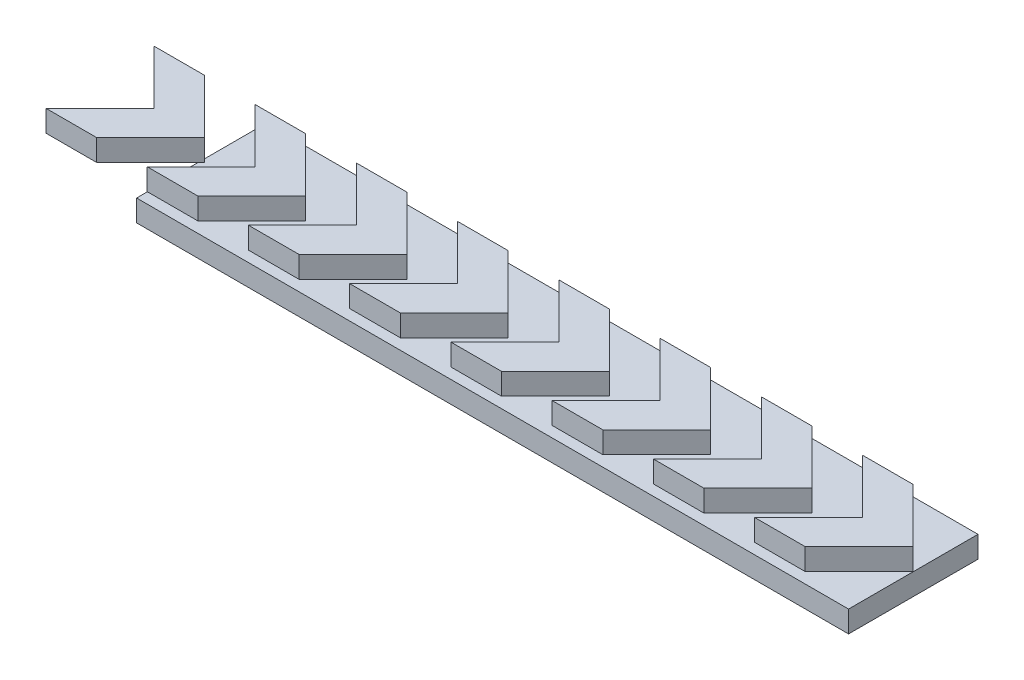
from build123d import *

# Parameters (mm, degrees)
SKETCH1_W             = 330
SKETCH1_H             = 60
BOSS_EXTRUDE1_DEPTH   = 10
BOSS_EXTRUDE2_DEPTH   = 10
BOSS_EXTRUDE2_2_DEPTH = 10
BOSS_EXTRUDE2_3_DEPTH = 10
BOSS_EXTRUDE2_4_DEPTH = 10
BOSS_EXTRUDE2_5_DEPTH = 10
BOSS_EXTRUDE2_6_DEPTH = 10
BOSS_EXTRUDE2_7_DEPTH = 10
BOSS_EXTRUDE2_8_DEPTH = 10


with BuildPart() as part:
    # Sketch1 → Boss-Extrude1 (new body)
    with BuildSketch(Plane(origin=(0, 0, 0), x_dir=(1, 0, 0), z_dir=(0, 1, 0))):
        Rectangle(SKETCH1_W, SKETCH1_H)
    extrude(amount=BOSS_EXTRUDE1_DEPTH)


with BuildPart() as body_2:
    # Sketch2 → Boss-Extrude2 (new body)
    with BuildSketch(Plane(origin=(0, 10, 0), x_dir=(1, 0, 0), z_dir=(0, 1, 0))):
        Polygon((-212, 25), (-187, 0), (-212, -25), (-188.538461538, -25), (-163.538461538, 0), (-188.538461538, 25), align=None)
    extrude(amount=BOSS_EXTRUDE2_DEPTH)


with BuildPart() as body_3:
    # Sketch2 → Boss-Extrude2 2 (new body)
    with BuildSketch(Plane(origin=(0, 10, 0), x_dir=(1, 0, 0), z_dir=(0, 1, 0))):
        Polygon((-141.615384615, 25), (-165.076923077, 25), (-140.076923077, 0), (-165.076923077, -25), (-141.615384615, -25), (-116.615384615, 0), align=None)
    extrude(amount=BOSS_EXTRUDE2_2_DEPTH)


with BuildPart() as body_4:
    # Sketch2 → Boss-Extrude2 3 (new body)
    with BuildSketch(Plane(origin=(0, 10, 0), x_dir=(1, 0, 0), z_dir=(0, 1, 0))):
        Polygon((-94.692307692, 25), (-118.153846154, 25), (-93.153846154, 0), (-118.153846154, -25), (-94.692307692, -25), (-69.692307692, 0), align=None)
    extrude(amount=BOSS_EXTRUDE2_3_DEPTH)


with BuildPart() as body_5:
    # Sketch2 → Boss-Extrude2 4 (new body)
    with BuildSketch(Plane(origin=(0, 10, 0), x_dir=(1, 0, 0), z_dir=(0, 1, 0))):
        Polygon((-47.769230769, 25), (-71.230769231, 25), (-46.230769231, 0), (-71.230769231, -25), (-47.769230769, -25), (-22.769230769, 0), align=None)
    extrude(amount=BOSS_EXTRUDE2_4_DEPTH)


with BuildPart() as body_6:
    # Sketch2 → Boss-Extrude2 5 (new body)
    with BuildSketch(Plane(origin=(0, 10, 0), x_dir=(1, 0, 0), z_dir=(0, 1, 0))):
        Polygon((-0.846153846, 25), (-24.307692308, 25), (0.692307692, 0), (-24.307692308, -25), (-0.846153846, -25), (24.153846154, 0), align=None)
    extrude(amount=BOSS_EXTRUDE2_5_DEPTH)


with BuildPart() as body_7:
    # Sketch2 → Boss-Extrude2 6 (new body)
    with BuildSketch(Plane(origin=(0, 10, 0), x_dir=(1, 0, 0), z_dir=(0, 1, 0))):
        Polygon((46.076923077, 25), (22.615384615, 25), (47.615384615, 0), (22.615384615, -25), (46.076923077, -25), (71.076923077, 0), align=None)
    extrude(amount=BOSS_EXTRUDE2_6_DEPTH)


with BuildPart() as body_8:
    # Sketch2 → Boss-Extrude2 7 (new body)
    with BuildSketch(Plane(origin=(0, 10, 0), x_dir=(1, 0, 0), z_dir=(0, 1, 0))):
        Polygon((93, 25), (69.538461538, 25), (94.538461538, 0), (69.538461538, -25), (93, -25), (118, 0), align=None)
    extrude(amount=BOSS_EXTRUDE2_7_DEPTH)


with BuildPart() as body_9:
    # Sketch2 → Boss-Extrude2 8 (new body)
    with BuildSketch(Plane(origin=(0, 10, 0), x_dir=(1, 0, 0), z_dir=(0, 1, 0))):
        Polygon((139.923076923, 25), (116.461538462, 25), (141.461538462, 0), (116.461538462, -25), (139.923076923, -25), (164.923076923, 0), align=None)
    extrude(amount=BOSS_EXTRUDE2_8_DEPTH)


solid = Compound([part.part, body_2.part, body_3.part, body_4.part, body_5.part, body_6.part, body_7.part, body_8.part, body_9.part])
